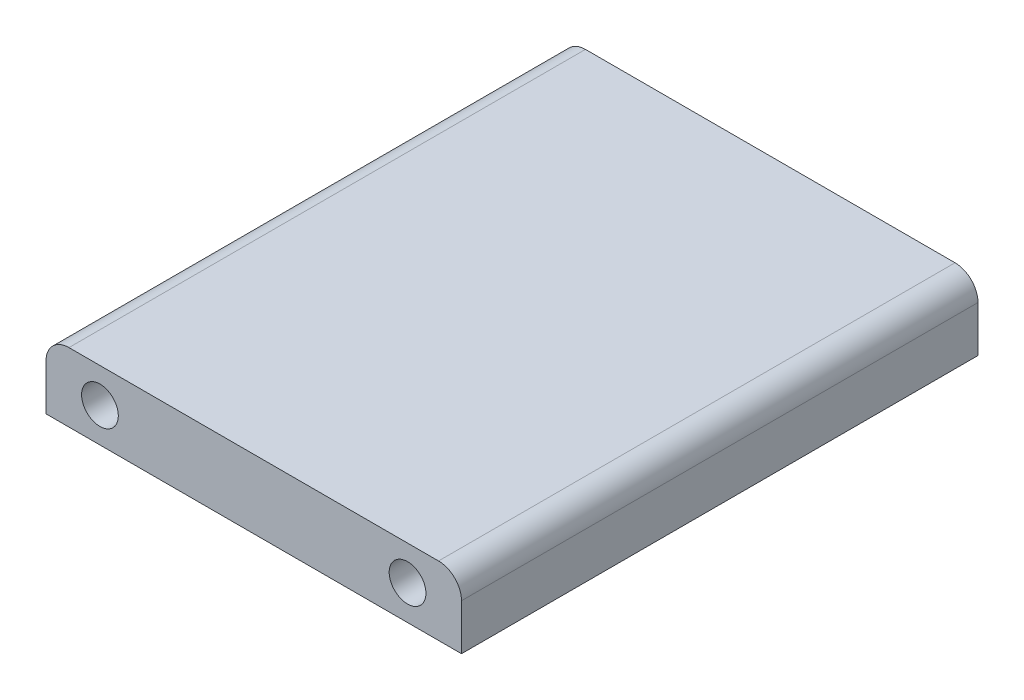
from build123d import *

# Parameters (mm, degrees)
SKETCH1_W           = 36.2
SKETCH1_H           = 45
BOSS_EXTRUDE1_DEPTH = 6
FILLET1_R           = 2
SKETCH3_R           = 1.6
CUT_EXTRUDE1_DEPTH  = 49.873407902


with BuildPart() as part:
    # Sketch1 → Boss-Extrude1 (new body)
    with BuildSketch(Plane(origin=(0, 0, 0), x_dir=(1, 0, 0), z_dir=(0, 1, 0))):
        Rectangle(SKETCH1_W, SKETCH1_H)
    extrude(amount=BOSS_EXTRUDE1_DEPTH)

    # Fillet1
    fillet1_edges = [part.edges().sort_by_distance(p)[0] for p in [
        (-18.1, 6, 0),
        (18.1, 6, 0),
    ]]
    fillet(fillet1_edges, radius=FILLET1_R)

    # Sketch3 → Cut-Extrude1 (cut, through all)
    with BuildSketch(Plane.XY.offset(22.5)):
        with Locations((-13.4, 3)):
            Circle(SKETCH3_R)
        with Locations((13.4, 3)):
            Circle(SKETCH3_R)
    extrude(amount=-CUT_EXTRUDE1_DEPTH, mode=Mode.SUBTRACT)


solid = part.part
